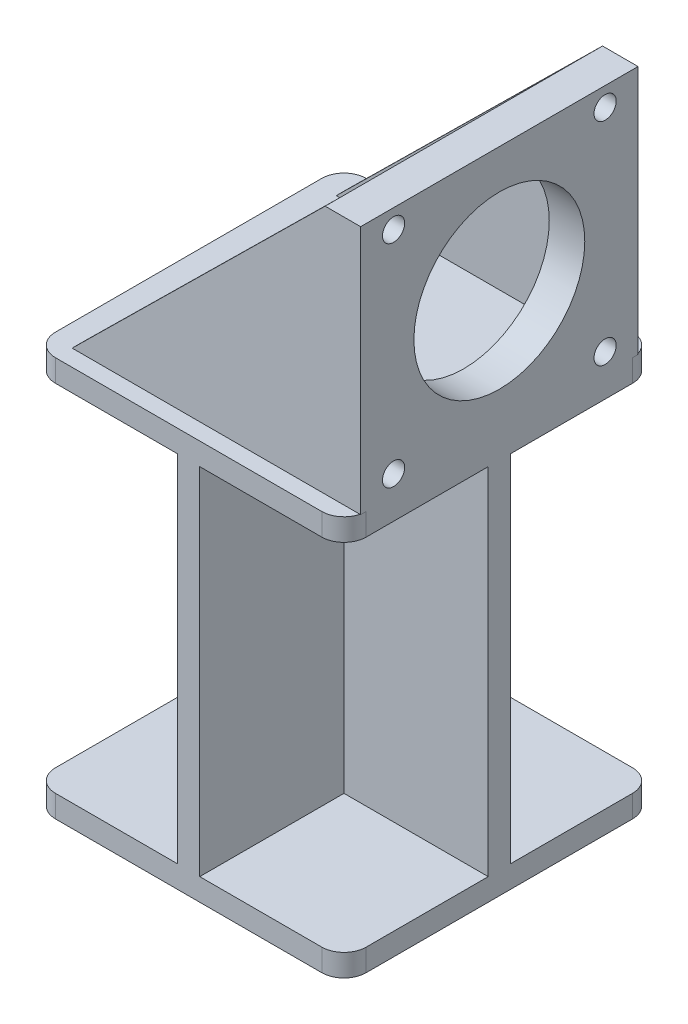
from build123d import *

# Parameters (mm, degrees)
BOSS_EXTRUDE1_DEPTH = 5
BOSS_EXTRUDE2_DEPTH = 80
SKETCH4_W           = 56.5
SKETCH4_H           = 56.2
SKETCH4_R           = 19.25
SKETCH4_R_2         = 2.5
BOSS_EXTRUDE3_DEPTH = 8
BOSS_EXTRUDE4_DEPTH = 3


with BuildPart() as part:
    # Sketch2 → Boss-Extrude1 (new body)
    with BuildSketch(Plane(origin=(0, 0, 0), x_dir=(1, 0, 0), z_dir=(0, 1, 0))):
        with BuildLine():
            Line((-30, -35), (30, -35))
            ThreePointArc((30, -35), (33.535533906, -33.535533906), (35, -30))
            Line((35, -30), (35, 30))
            ThreePointArc((35, 30), (33.535533906, 33.535533906), (30, 35))
            Line((30, 35), (-30, 35))
            ThreePointArc((-30, 35), (-33.535533906, 33.535533906), (-35, 30))
            Line((-35, 30), (-35, -30))
            ThreePointArc((-35, -30), (-33.535533906, -33.535533906), (-30, -35))
        make_face()
    boss_extrude1 = extrude(amount=BOSS_EXTRUDE1_DEPTH)

    # Sketch3 → Boss-Extrude2 (add)
    with BuildSketch(Plane(origin=(0, 5, 0), x_dir=(1, 0, 0), z_dir=(0, 1, 0))):
        Polygon((-2.5, 2.5), (-2.5, 35), (2.5, 35), (2.5, 2.5), (35, 2.5), (35, -2.5), (2.5, -2.5), (2.5, -35), (-2.5, -35), (-2.5, -2.5), (-35, -2.5), (-35, 2.5), align=None)
    extrude(amount=BOSS_EXTRUDE2_DEPTH)

    # Mirror1: Boss-Extrude1 across plane
    add(boss_extrude1.mirror(Plane.ZX.offset(45)))

    # Sketch4 → Boss-Extrude3 (add)
    with BuildSketch(Plane(origin=(35, 0, 0), x_dir=(0, 0, -1), z_dir=(1, 0, 0))):
        with Locations((0, 118.1)):
            Rectangle(SKETCH4_W, SKETCH4_H)
        with Locations((0, 118.1)):
            Circle(SKETCH4_R, mode=Mode.SUBTRACT)
        with Locations((-23.829498526, 141.929498526)):
            Circle(SKETCH4_R_2, mode=Mode.SUBTRACT)
        with Locations(Location((23.829498526, 141.929498526, 0), (0, 0, 180))):
            Circle(SKETCH4_R_2, mode=Mode.SUBTRACT)
        with Locations((23.829498526, 94.270501474)):
            Circle(SKETCH4_R_2, mode=Mode.SUBTRACT)
        with Locations(Location((-23.829498526, 94.270501474, 0), (0, 0, 180))):
            Circle(SKETCH4_R_2, mode=Mode.SUBTRACT)
    extrude(amount=-BOSS_EXTRUDE3_DEPTH)

    # Sketch5 → Boss-Extrude4 (add)
    with BuildSketch(Plane.XY.offset(28.25)):
        Polygon((35, 90), (-30, 90), (27, 146.2), (35, 146.2), align=None)
    boss_extrude4 = extrude(amount=BOSS_EXTRUDE4_DEPTH)

    # Mirror2: Boss-Extrude4 across plane
    add(boss_extrude4.mirror(Plane(origin=(0, 0, 0), x_dir=(1, 0, 0), z_dir=(0, 0, -1))))


solid = part.part
